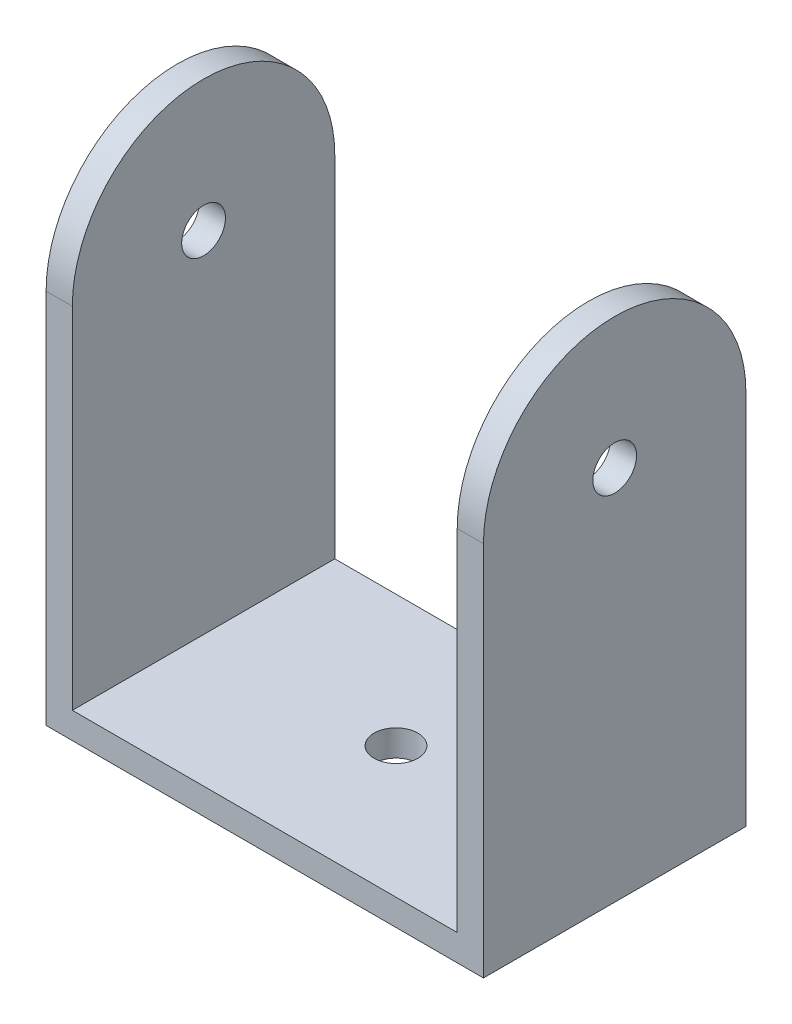
from build123d import *

# Parameters (mm, degrees)
SKETCH1_W           = 50
SKETCH1_H           = 30
BOSS_EXTRUDE1_DEPTH = 3
SKETCH2_R           = 2.5
BOSS_EXTRUDE2_DEPTH = 3
SKETCH3_R           = 2.5
CUT_EXTRUDE1_DEPTH  = 3


with BuildPart() as part:
    # Sketch1 → Boss-Extrude1 (new body)
    with BuildSketch(Plane(origin=(0, 0, 0), x_dir=(1, 0, 0), z_dir=(0, 1, 0))):
        Rectangle(SKETCH1_W, SKETCH1_H)
    extrude(amount=BOSS_EXTRUDE1_DEPTH)

    # Sketch2 → Boss-Extrude2 (add)
    with BuildSketch(Plane(origin=(25, 0, 0), x_dir=(0, 0, -1), z_dir=(1, 0, 0))):
        with BuildLine():
            Line((-15, 3), (-15, 43))
            ThreePointArc((-15, 43), (0, 58), (15, 43))
            Line((15, 43), (15, 3))
            Line((15, 3), (-15, 3))
        make_face()
        with Locations((0, 43)):
            Circle(SKETCH2_R, mode=Mode.SUBTRACT)
    boss_extrude2 = extrude(amount=-BOSS_EXTRUDE2_DEPTH)

    # Mirror1: Boss-Extrude2 across plane
    add(boss_extrude2.mirror(Plane(origin=(0, 0, 0), x_dir=(0, 0, 1), z_dir=(1, 0, 0))))

    # Sketch3 → Cut-Extrude1 (cut)
    with BuildSketch(Plane(origin=(0, 3, 0), x_dir=(1, 0, 0), z_dir=(0, 1, 0))):
        with Locations(Location((0, 0, 0), (0, 0, 270))):
            Circle(SKETCH3_R)
    extrude(amount=-CUT_EXTRUDE1_DEPTH, mode=Mode.SUBTRACT)


solid = part.part
